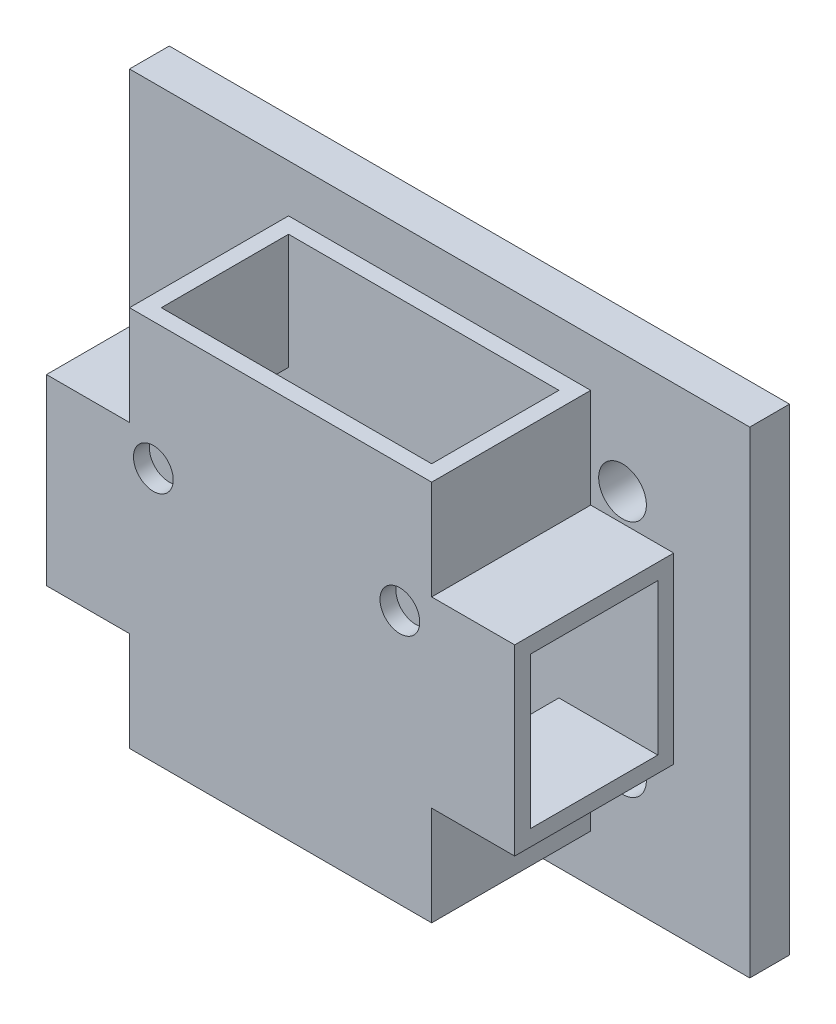
from build123d import *

# Parameters (mm, degrees)
SKETCH1_W           = 78
SKETCH1_H           = 60
BOSS_EXTRUDE1_DEPTH = 5
SKETCH7_R           = 3
CUT_EXTRUDE4_DEPTH  = 56.605062255
SKETCH8_W           = 38
SKETCH8_H           = 48
BOSS_EXTRUDE2_DEPTH = 20
SKETCH9_W           = 58.87856647
SKETCH9_H           = 23
BOSS_EXTRUDE3_DEPTH = 20
SKETCH10_W          = 16
SKETCH10_H          = 19
CUT_EXTRUDE5_DEPTH  = 60
SKETCH11_W          = 34
SKETCH11_H          = 16
CUT_EXTRUDE6_DEPTH  = 60
SKETCH12_R          = 2.5
CUT_EXTRUDE7_DEPTH  = 9


with BuildPart() as part:
    # Sketch1 → Boss-Extrude1 (new body)
    with BuildSketch(Plane.XY):
        with Locations((-0.21253406, 9.10626703)):
            Rectangle(SKETCH1_W, SKETCH1_H)
    extrude(amount=BOSS_EXTRUDE1_DEPTH)

    # Sketch7 → Cut-Extrude4 (cut, through all)
    with BuildSketch(Plane.XY.offset(5)):
        with Locations((-23.21253406, 24.10626703)):
            Circle(SKETCH7_R)
        with Locations((22.78746594, 24.10626703)):
            Circle(SKETCH7_R)
        with Locations((22.78746594, -5.89373297)):
            Circle(SKETCH7_R)
        with Locations((-23.21253406, -5.89373297)):
            Circle(SKETCH7_R)
    extrude(amount=-CUT_EXTRUDE4_DEPTH, mode=Mode.SUBTRACT)

    # Sketch8 → Boss-Extrude2 (add)
    with BuildSketch(Plane.XY.offset(5)):
        with Locations((-0.21253406, 9.10626703)):
            Rectangle(SKETCH8_W, SKETCH8_H)
    extrude(amount=BOSS_EXTRUDE2_DEPTH)

    # Sketch9 → Boss-Extrude3 (add)
    with BuildSketch(Plane.XY.offset(5)):
        with Locations((-0.21253406, 9.10626703)):
            Rectangle(SKETCH9_W, SKETCH9_H)
    extrude(amount=BOSS_EXTRUDE3_DEPTH)

    # Sketch10 → Cut-Extrude5 (cut)
    with BuildSketch(Plane.ZY.offset(29.651817295)):
        with Locations((15, 9.10626703)):
            Rectangle(SKETCH10_W, SKETCH10_H)
    extrude(amount=-CUT_EXTRUDE5_DEPTH, mode=Mode.SUBTRACT)

    # Sketch11 → Cut-Extrude6 (cut)
    with BuildSketch(Plane.XZ.offset(14.89373297)):
        with Locations((-0.21253406, 15)):
            Rectangle(SKETCH11_W, SKETCH11_H)
    extrude(amount=-CUT_EXTRUDE6_DEPTH, mode=Mode.SUBTRACT)

    # Sketch12 → Cut-Extrude7 (cut)
    with BuildSketch(Plane.XY.offset(25)):
        with Locations((-16.211721725, 17.10626703)):
            Circle(SKETCH12_R)
        with Locations((14.788278275, 17.10626703)):
            Circle(SKETCH12_R)
    extrude(amount=-CUT_EXTRUDE7_DEPTH, mode=Mode.SUBTRACT)


solid = part.part
